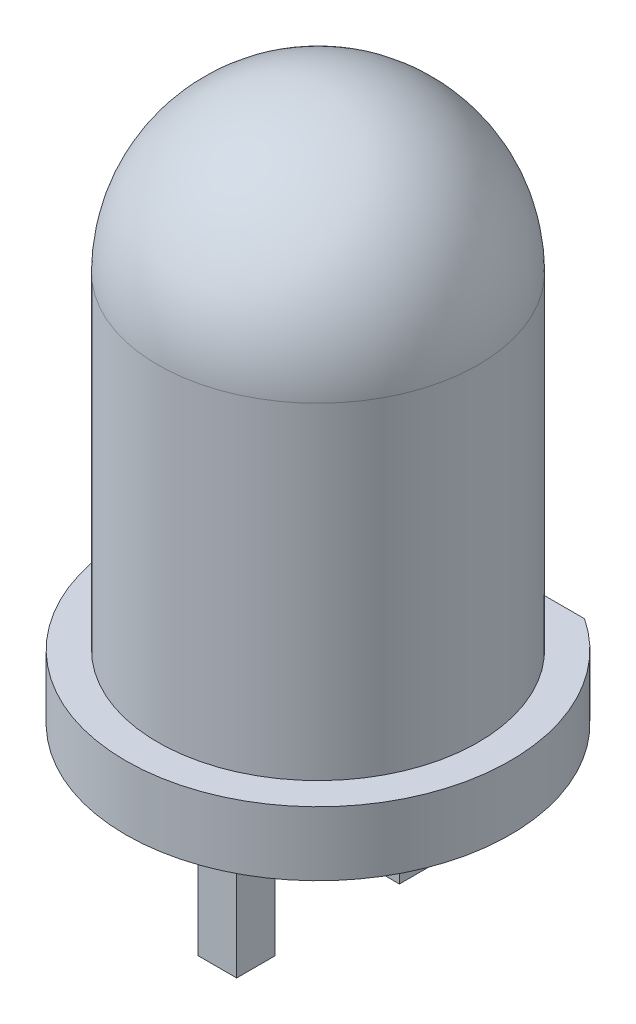
from build123d import *

# Parameters (mm, degrees)
ESBO_O4_W                = 7.252623502
ESBO_O4_H                = 0.751020135
CORTE_EXTRUS_O1_DEPTH    = 1
ESBO_O5_W                = 0.6
ESBO_O5_H                = 0.6
RESSALTO_EXTRUS_O1_DEPTH = 27
ESBO_O6_W                = 0.6
ESBO_O6_H                = 0.6
CORTE_EXTRUS_O2_DEPTH    = 1.5
ESBO_O27_R               = 4.624654595
CORTE_EXTRUS_O3_DEPTH    = 24.5


with BuildPart() as part:
    # Esboço1 → Revolução1 (revolve)
    with BuildSketch(Plane(origin=(0, 0, 0), x_dir=(0, 0, -1), z_dir=(1, 0, 0))):
        with BuildLine():
            Line((0, 0), (0, 8.6))
            ThreePointArc((0, 8.6), (1.767766953, 7.867766953), (2.5, 6.1))
            Line((2.5, 6.1), (2.5, 1))
            Line((2.5, 1), (3, 1))
            Line((3, 1), (3, 0))
            Line((3, 0), (0, 0))
        make_face()
    revolve(axis=Axis((0, 0, 0), (0, 1, 0)))

    # Esboço4 → Corte-extrusão1 (cut)
    with BuildSketch(Plane(origin=(0, 0, 0), x_dir=(1, 0, 0), z_dir=(0, 1, 0))):
        with Locations((0, 2.875510068)):
            Rectangle(ESBO_O4_W, ESBO_O4_H)
    extrude(amount=CORTE_EXTRUS_O1_DEPTH, mode=Mode.SUBTRACT)

    # Esboço5 → Ressalto-extrusão1 (add)
    with BuildSketch(Plane.XZ):
        with Locations((0, 1.27)):
            Rectangle(ESBO_O5_W, ESBO_O5_H)
        with Locations((0, -1.27)):
            Rectangle(ESBO_O5_W, ESBO_O5_H)
    extrude(amount=RESSALTO_EXTRUS_O1_DEPTH)

    # Esboço6 → Corte-extrusão2 (cut)
    with BuildSketch(Plane.XZ.offset(27)):
        with Locations((0, -1.27)):
            Rectangle(ESBO_O6_W, ESBO_O6_H)
    extrude(amount=-CORTE_EXTRUS_O2_DEPTH, mode=Mode.SUBTRACT)

    # Esboço27 → Corte-extrusão3 (cut)
    with BuildSketch(Plane.XZ.offset(27)):
        Circle(ESBO_O27_R)
    extrude(amount=-CORTE_EXTRUS_O3_DEPTH, mode=Mode.SUBTRACT)


solid = part.part
